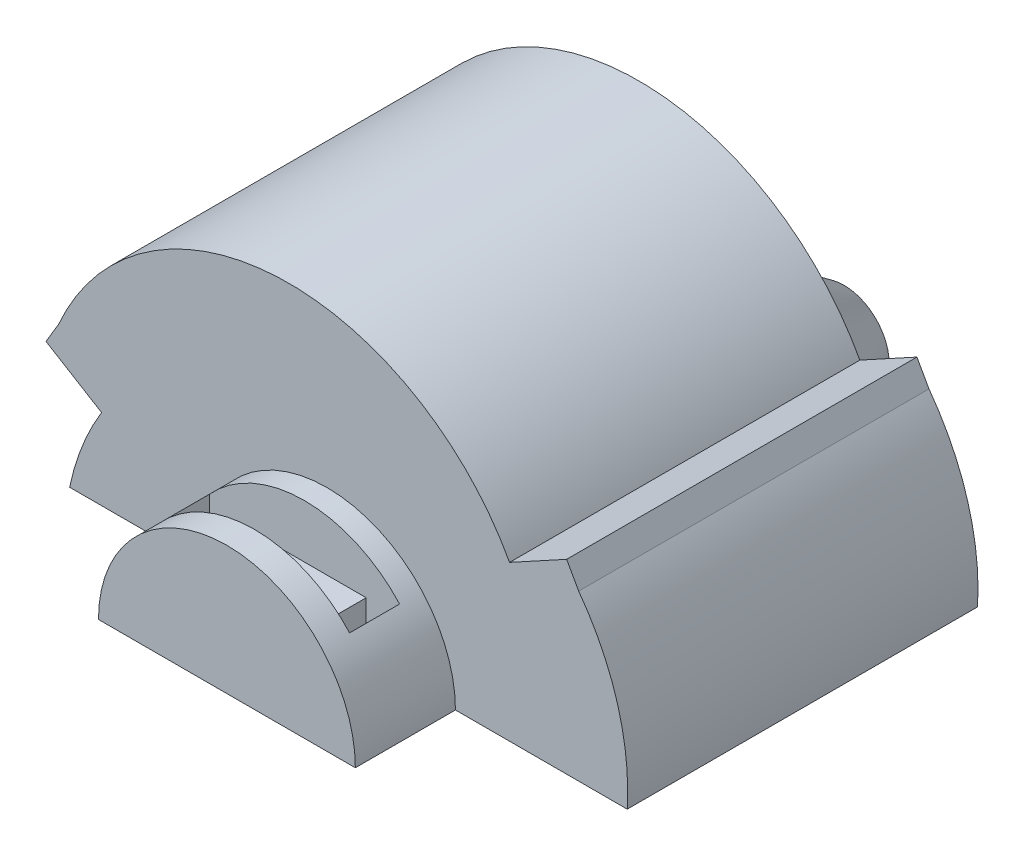
from build123d import *

# Parameters (mm, degrees)
SALIENTE_EXTRUIR1_DEPTH = 18
SALIENTE_EXTRUIR2_START = 1.5
CROQUIS2_R              = 2.7
SALIENTE_EXTRUIR2_DEPTH = 1.5
SALIENTE_EXTRUIR3_DEPTH = 1.5
CROQUIS6_W              = 5.4
CROQUIS6_H              = 1.181933233
SALIENTE_EXTRUIR7_DEPTH = 10
CROQUIS7_W              = 5.4
CROQUIS7_H              = 10
CORTAR_EXTRUIR2_DEPTH   = 16.5
CROQUIS9_W              = 52.468080771
CROQUIS9_H              = 55.683263094
CORTAR_EXTRUIR3_DEPTH   = 30
CROQUIS10_W             = 2
CROQUIS10_H             = 3
CROQUIS10_H_2           = 2.995767736
CORTAR_EXTRUIR4_DEPTH   = 10
CROQUIS11_W             = 2.995767736
CROQUIS11_H             = 6.287117146
CROQUIS11_W_2           = 3
CROQUIS11_H_2           = 6.399149596
CORTAR_EXTRUIR5_DEPTH   = 7.4
CROQUIS12_W             = 3.7
CROQUIS12_H             = 3
REVOLUCI_N2_ANGLE       = 180


with BuildPart() as part:
    # Croquis1 → Saliente-Extruir1 (new body)
    with BuildSketch(Plane.XY):
        with BuildLine():
            Line((-54.535099114, 31.482780649), (-55.25791247, 32.775048384))
            Line((-55.25791247, 32.775048384), (-58.679569293, 30.903614553))
            ThreePointArc((-58.679569293, 30.903614553), (-72.555259572, 38.768368337), (-85.712228427, 29.752642999))
            Line((-85.712228427, 29.752642999), (-86.469958437, 28.480534403))
            Line((-86.469958437, 28.480534403), (-83.138420786, 26.453009587))
            ThreePointArc((-83.138420786, 26.453009587), (-83.011652218, 10.503932418), (-68.625320614, 3.617525822))
            Line((-68.625320614, 3.617525822), (-67.144777249, 3.597366682))
            Line((-67.144777249, 3.597366682), (-67.054658077, 7.49632533))
            ThreePointArc((-67.054658077, 7.49632533), (-53.305736365, 15.580648714), (-54.535099114, 31.482780649))
        make_face()
        with BuildLine():
            Line((-69.624216052, 5.117649823), (-68.624216052, 5.117649823))
            Line((-68.624216052, 5.117649823), (-68.624216052, 9.117649823))
            ThreePointArc((-68.624216052, 9.117649823), (-55.305921191, 15.218525867), (-55.334796889, 29.867649823))
            Line((-55.334796889, 29.867649823), (-55.834796889, 30.733675227))
            Line((-55.834796889, 30.733675227), (-59.298898504, 28.733675227))
            ThreePointArc((-59.298898504, 28.733675227), (-71.241559574, 37.21721889), (-83.913635214, 29.867649823))
            Line((-83.913635214, 29.867649823), (-84.413635214, 29.001624419))
            Line((-84.413635214, 29.001624419), (-80.949533599, 27.001624419))
            ThreePointArc((-80.949533599, 27.001624419), (-82.325167391, 12.417204713), (-69.624216052, 5.117649823))
        make_face(mode=Mode.SUBTRACT)
    extrude(amount=SALIENTE_EXTRUIR1_DEPTH)

    # Croquis2 → Saliente-Extruir2 (add)
    with BuildSketch(Plane(origin=(0, 0, 0), x_dir=(-1, 0, 0), z_dir=(0, 0, -1)).offset(SALIENTE_EXTRUIR2_START)):
        with BuildLine():
            Line((67.054658077, 7.49632533), (67.144777249, 3.597366682))
            Line((67.144777249, 3.597366682), (68.625320614, 3.617525822))
            ThreePointArc((68.625320614, 3.617525822), (83.011652218, 10.503932418), (83.138420786, 26.453009587))
            Line((83.138420786, 26.453009587), (86.469958437, 28.480534403))
            Line((86.469958437, 28.480534403), (85.712228427, 29.752642999))
            ThreePointArc((85.712228427, 29.752642999), (72.555259572, 38.768368337), (58.679569293, 30.903614553))
            Line((58.679569293, 30.903614553), (55.25791247, 32.775048384))
            Line((55.25791247, 32.775048384), (54.535099114, 31.482780649))
            ThreePointArc((54.535099114, 31.482780649), (53.305736365, 15.580648714), (67.054658077, 7.49632533))
        make_face()
        with Locations((69.624216052, 21.617649823)):
            Circle(CROQUIS2_R, mode=Mode.SUBTRACT)
    extrude(amount=-SALIENTE_EXTRUIR2_DEPTH)

    # Croquis3 → Saliente-Extruir3 (add)
    with BuildSketch(Plane.XY.offset(18)):
        with BuildLine():
            Line((-67.144777249, 3.597366682), (-67.054658077, 7.49632533))
            ThreePointArc((-67.054658077, 7.49632533), (-53.305736365, 15.580648714), (-54.535099114, 31.482780649))
            Line((-54.535099114, 31.482780649), (-55.25791247, 32.775048384))
            Line((-55.25791247, 32.775048384), (-58.679569293, 30.903614553))
            ThreePointArc((-58.679569293, 30.903614553), (-72.555259572, 38.768368337), (-85.712228427, 29.752642999))
            Line((-85.712228427, 29.752642999), (-86.469958437, 28.480534403))
            Line((-86.469958437, 28.480534403), (-83.138420786, 26.453009587))
            ThreePointArc((-83.138420786, 26.453009587), (-83.011652218, 10.503932418), (-68.625320614, 3.617525822))
            Line((-68.625320614, 3.617525822), (-67.144777249, 3.597366682))
        make_face()
    extrude(amount=SALIENTE_EXTRUIR3_DEPTH)

    # Croquis6 → Saliente-Extruir7 (add)
    with BuildSketch(Plane(origin=(0, 0, -1.5), x_dir=(-1, 0, 0), z_dir=(0, 0, -1))):
        with Locations((69.624216052, 21.026683207)):
            Rectangle(CROQUIS6_W, CROQUIS6_H)
    extrude(amount=SALIENTE_EXTRUIR7_DEPTH)

    # Croquis7 → Cortar-Extruir2 (cut)
    with BuildSketch(Plane(origin=(0, 21.617649823, 0), x_dir=(1, 0, 0), z_dir=(0, 1, 0))):
        with Locations((-69.624216052, 6.5)):
            Rectangle(CROQUIS7_W, CROQUIS7_H)
    extrude(amount=-CORTAR_EXTRUIR2_DEPTH, mode=Mode.SUBTRACT)

    # Croquis8 → Revolución1 (revolve)
    with BuildSketch(Plane(origin=(0, 21.617649823, 0), x_dir=(1, 0, 0), z_dir=(0, 1, 0)), mode=Mode.PRIVATE) as revoluci_n1_sk:
        Polygon((-72.324216052, 1.5), (-79.486781688, 1.5), (-72.324216052, 11.5), align=None)
        Polygon((-72.324216052, -19.5), (-69.624216052, -19.5), (-69.624216052, -25.5), (-72.324216052, -25.5), (-77.324216052, -25.5), (-77.324216052, -19.5), align=None)
    revolve(revoluci_n1_sk.sketch.rotate(Axis((-69.624216052, 21.617649823, 19.5), (0, 0, 1)), 180), axis=Axis((-69.624216052, 21.617649823, 19.5), (0, 0, 1)))

    # Croquis9 → Cortar-Extruir3 (cut)
    with BuildSketch(Plane(origin=(0, 21.617649823, 0), x_dir=(1, 0, 0), z_dir=(0, 1, 0))):
        with Locations((-61.70964897, -8.735329994)):
            Rectangle(CROQUIS9_W, CROQUIS9_H)
    extrude(amount=-CORTAR_EXTRUIR3_DEPTH, mode=Mode.SUBTRACT)

    # Croquis10 → Cortar-Extruir4 (cut)
    with BuildSketch(Plane.XZ.offset(-21.617649823)):
        with Locations((-64.924216052, -4)):
            Rectangle(CROQUIS10_W, CROQUIS10_H)
        with Locations((-74.324216052, -4)):
            Rectangle(CROQUIS10_W, CROQUIS10_H)
        with Locations((-64.924216052, 22.347883868)):
            Rectangle(CROQUIS10_W, CROQUIS10_H_2)
        with Locations((-74.324216052, 22.347883868)):
            Rectangle(CROQUIS10_W, CROQUIS10_H_2)
    extrude(amount=-CORTAR_EXTRUIR4_DEPTH, mode=Mode.SUBTRACT)

    # Croquis11 → Cortar-Extruir5 (cut)
    with BuildSketch(Plane.ZY.offset(73.324216052)):
        with Locations((22.347883868, 29.264688265)):
            Rectangle(CROQUIS11_W, CROQUIS11_H)
        with Locations((-4, 30.385140174)):
            Rectangle(CROQUIS11_W_2, CROQUIS11_H_2)
    extrude(amount=-CORTAR_EXTRUIR5_DEPTH, mode=Mode.SUBTRACT)

    # Croquis12 → Revolución2 (revolve)
    with BuildSketch(Plane.XZ.offset(-21.617649823)):
        with Locations((-71.474216052, 16.5)):
            Rectangle(CROQUIS12_W, CROQUIS12_H)
    revolve(axis=Axis((-69.624216052, 21.617649823, 18), (0, 0, -1)), revolution_arc=REVOLUCI_N2_ANGLE)


solid = part.part
